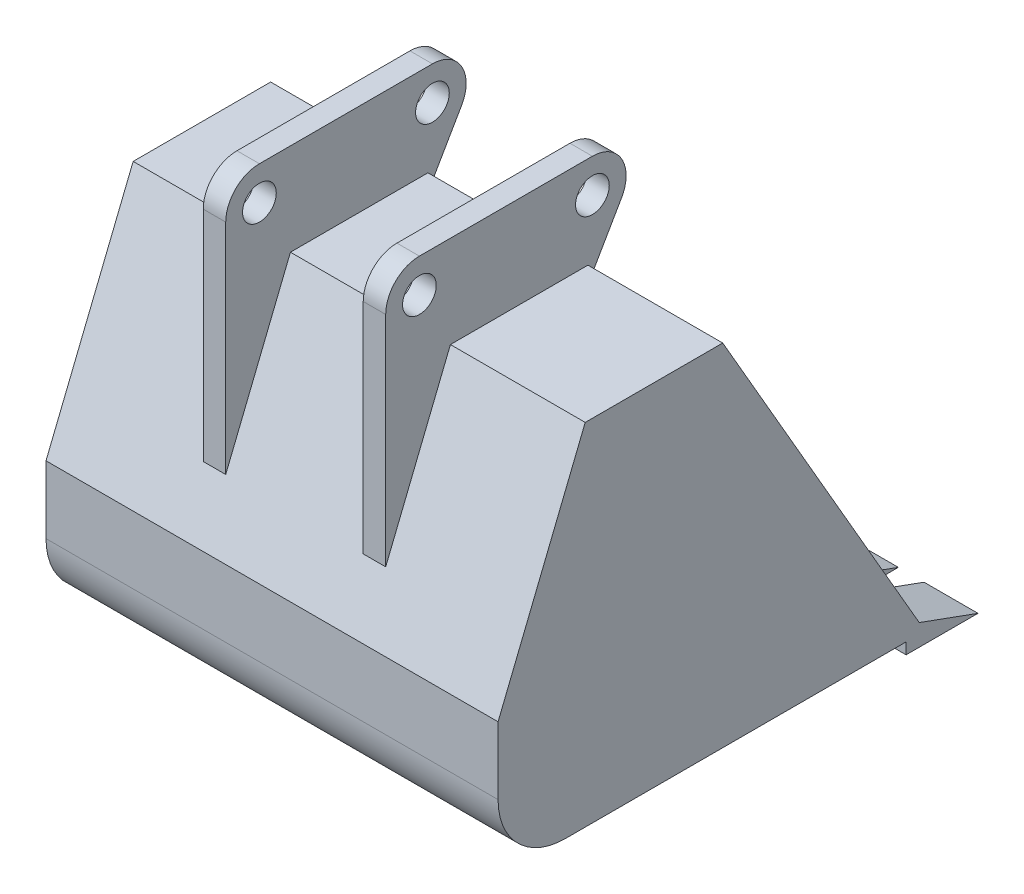
from build123d import *

# Parameters (mm, degrees)
BOSS_EXTRUDE1_DEPTH = 503
CUT_EXTRUDE1_DEPTH  = 463
CUT_EXTRUDE2_DEPTH  = 28.6
LPATTERN1_COUNT     = 3
LPATTERN1_PITCH     = 177.2
LPATTERN1_COL_COUNT = 3
LPATTERN1_COL_PITCH = 177.2
SKETCH5_R           = 37.5
BOSS_EXTRUDE2_DEPTH = 50


with BuildPart() as part:
    # Sketch1 → Boss-Extrude1 (new, symmetric)
    with BuildSketch(Plane(origin=(0, 0, 0), x_dir=(0, 0, -1), z_dir=(1, 0, 0))):
        with BuildLine():
            Line((150, 0), (908, 0))
            Line((908, 0), (908, -25))
            Line((908, -25), (1068, -25))
            Line((1068, -25), (937.217045761, 22.601102492))
            Line((937.217045761, 22.601102492), (499.932588401, 780))
            Line((499.932588401, 780), (193.932588401, 780))
            Line((193.932588401, 780), (0, 300))
            Line((0, 300), (0, 150))
            ThreePointArc((0, 150), (43.933982822, 43.933982822), (150, 0))
        make_face()
    extrude(amount=BOSS_EXTRUDE1_DEPTH, both=True)

    # Sketch2 → Cut-Extrude1 (cut, symmetric)
    with BuildSketch(Plane(origin=(0, 0, 0), x_dir=(0, 0, -1), z_dir=(1, 0, 0))):
        with BuildLine():
            Line((908, 40), (1011.713283141, 40))
            Line((1011.713283141, 40), (1011.713283141, 740))
            Line((1011.713283141, 740), (499.932588401, 740))
            Line((499.932588401, 740), (220.912929075, 740))
            Line((220.912929075, 740), (40, 292.224787634))
            Line((40, 292.224787634), (40, 150))
            ThreePointArc((40, 150), (72.218254069, 72.218254069), (150, 40))
            Line((150, 40), (908, 40))
        make_face()
    extrude(amount=CUT_EXTRUDE1_DEPTH, both=True, mode=Mode.SUBTRACT)

    # Sketch3 → Cut-Extrude2 (cut, symmetric)
    with BuildSketch(Plane(origin=(0, 0, 0), x_dir=(0, 0, -1), z_dir=(1, 0, 0))):
        Polygon((946.796612299, 48.920745244), (905.079735991, -65.695430422), (1089.944771032, -65.695430422), (1089.944771032, 48.920745244), align=None)
    cut_extrude2 = extrude(amount=CUT_EXTRUDE2_DEPTH, both=True, mode=Mode.SUBTRACT)

    # LPattern1: Cut-Extrude2 ×3
    with Locations(*[(i * LPATTERN1_PITCH, 0, 0) for i in range(1, LPATTERN1_COUNT)]):
        add(cut_extrude2, mode=Mode.SUBTRACT)

    # LPattern1 col: Cut-Extrude2 ×3
    with Locations(*[(-i * LPATTERN1_COL_PITCH, 0, 0) for i in range(1, LPATTERN1_COL_COUNT)]):
        add(cut_extrude2, mode=Mode.SUBTRACT)

    # Sketch5 → Boss-Extrude2 (add)
    with BuildSketch(Plane(origin=(153, 0, 0), x_dir=(0, 0, -1), z_dir=(1, 0, 0))):
        with BuildLine():
            Line((49.932588401, 423.587493108), (49.932588401, 910))
            ThreePointArc((49.932588401, 910), (71.899579812, 963.033008589), (124.932588401, 985))
            Line((124.932588401, 985), (509.932588401, 985))
            ThreePointArc((509.932588401, 985), (574.884493685, 947.5), (574.884493685, 872.5))
            Line((574.884493685, 872.5), (510.706091093, 761.339745962))
            Line((510.706091093, 761.339745962), (499.932588401, 780))
            Line((499.932588401, 780), (193.932588401, 780))
            Line((193.932588401, 780), (49.932588401, 423.587493108))
        make_face()
        with Locations((124.932588401, 910)):
            Circle(SKETCH5_R, mode=Mode.SUBTRACT)
        with Locations((509.932588401, 910)):
            Circle(SKETCH5_R, mode=Mode.SUBTRACT)
    boss_extrude2 = extrude(amount=BOSS_EXTRUDE2_DEPTH)

    # Mirror1: Boss-Extrude2 across plane
    add(boss_extrude2.mirror(Plane(origin=(0, 0, 0), x_dir=(0, 0, 1), z_dir=(1, 0, 0))))


solid = part.part
